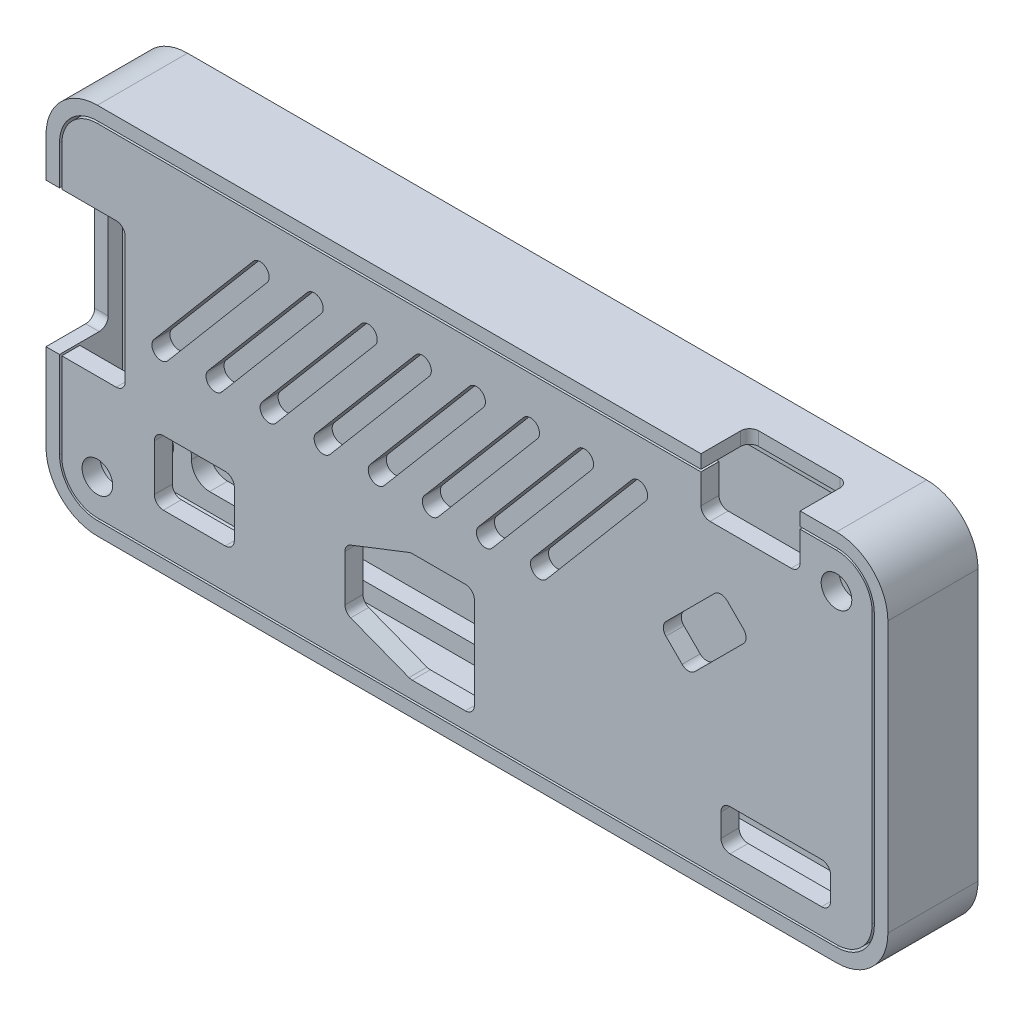
from build123d import *

# Parameters (mm, degrees)
BOSS_EXTRUDE1_DEPTH   = 3
BOSS_EXTRUDE2_START   = 7
BOSS_EXTRUDE2_DEPTH   = 7
M3X0_5_TAPPED_HOLE1_D = 2.9
CUT_EXTRUDE1_DEPTH    = 2
FILLET1_R             = 2
BOSS_EXTRUDE3_DEPTH   = 2
SKETCH6_W             = 8.782
SKETCH6_H             = 16
SKETCH6_W_2           = 8.874
SKETCH6_H_2           = 7.1596
SKETCH6_W_3           = 11
SKETCH6_H_3           = 6
SKETCH6_W_4           = 12.16
SKETCH6_H_4           = 4.54
CUT_EXTRUDE2_DEPTH    = 5.4
FILLET2_R             = 1
CUT_EXTRUDE3_DEPTH    = 2
SKETCH8_R             = 1.7
CUT_EXTRUDE4_DEPTH    = 101.424001115
FILLET3_R             = 1


with BuildPart() as part:
    # Sketch1 → Boss-Extrude1 (new body)
    with BuildSketch(Plane.XY):
        with BuildLine():
            Line((4, 39.7), (86, 39.7))
            ThreePointArc((86, 39.7), (90.030508653, 38.030508653), (91.7, 34))
            Line((91.7, 34), (91.7, 4))
            ThreePointArc((91.7, 4), (90.030508653, -0.030508653), (86, -1.7))
            Line((86, -1.7), (4, -1.7))
            ThreePointArc((4, -1.7), (-0.030508653, -0.030508653), (-1.7, 4))
            Line((-1.7, 4), (-1.7, 34))
            ThreePointArc((-1.7, 34), (-0.030508653, 38.030508653), (4, 39.7))
        make_face()
    extrude(amount=-BOSS_EXTRUDE1_DEPTH)

    # Sketch1<3> → Boss-Extrude2 (add)
    with BuildSketch(Plane.XY.offset(BOSS_EXTRUDE2_START)):
        with BuildLine():
            Line((4, 39.7), (86, 39.7))
            ThreePointArc((86, 39.7), (90.030508653, 38.030508653), (91.7, 34))
            Line((91.7, 34), (91.7, 4))
            ThreePointArc((91.7, 4), (90.030508653, -0.030508653), (86, -1.7))
            Line((86, -1.7), (4, -1.7))
            ThreePointArc((4, -1.7), (-0.030508653, -0.030508653), (-1.7, 4))
            Line((-1.7, 4), (-1.7, 34))
            ThreePointArc((-1.7, 34), (-0.030508653, 38.030508653), (4, 39.7))
        make_face()
        with BuildLine():
            Line((-0.2, 4), (-0.2, 34))
            ThreePointArc((-0.2, 34), (1.030151519, 36.969848481), (4, 38.2))
            Line((4, 38.2), (86, 38.2))
            ThreePointArc((86, 38.2), (88.969848481, 36.969848481), (90.2, 34))
            Line((90.2, 34), (90.2, 4))
            ThreePointArc((90.2, 4), (88.969848481, 1.030151519), (86, -0.2))
            Line((86, -0.2), (4, -0.2))
            ThreePointArc((4, -0.2), (1.030151519, 1.030151519), (-0.2, 4))
        make_face(mode=Mode.SUBTRACT)
    extrude(amount=-BOSS_EXTRUDE2_DEPTH)

    # M3x0.5 Tapped Hole1 (through all)
    with Locations(Plane.XY):
        with Locations((4, 34), (4, 4), (86, 4), (86, 34)):
            Hole(M3X0_5_TAPPED_HOLE1_D / 2)

    # Sketch4 → Cut-Extrude1 (cut)
    with BuildSketch(Plane.XY):
        with BuildLine():
            Line((1.8, 31.342463547), (1.8, 6.657536453))
            ThreePointArc((1.8, 6.657536453), (6.439518395, 6.439518395), (6.657536453, 1.8))
            Line((6.657536453, 1.8), (83.342463547, 1.8))
            ThreePointArc((83.342463547, 1.8), (83.560481605, 6.439518395), (88.2, 6.657536453))
            Line((88.2, 6.657536453), (88.2, 31.342463547))
            ThreePointArc((88.2, 31.342463547), (83.560481605, 31.560481605), (83.342463547, 36.2))
            Line((83.342463547, 36.2), (6.657536453, 36.2))
            ThreePointArc((6.657536453, 36.2), (6.439518395, 31.560481605), (1.8, 31.342463547))
        make_face()
    extrude(amount=-CUT_EXTRUDE1_DEPTH, mode=Mode.SUBTRACT)

    # Fillet1
    fillet1_edges = [part.edges().sort_by_distance(p)[0] for p in [
        (88.2, 6.657536453, -1),
        (83.342463547, 1.8, -1),
        (6.657536453, 1.8, -1),
        (1.8, 6.657536453, -1),
        (1.8, 31.342463547, -1),
        (6.657536453, 36.2, -1),
        (83.342463547, 36.2, -1),
        (88.2, 31.342463547, -1),
    ]]
    fillet(fillet1_edges, radius=FILLET1_R)


with BuildPart() as body_2:
    # Sketch5 → Boss-Extrude3 (new body)
    with BuildSketch(Plane.XY.offset(7)):
        with BuildLine():
            Line((86, 37.95), (4, 37.95))
            ThreePointArc((4, 37.95), (1.206928214, 36.793071786), (0.05, 34))
            Line((0.05, 34), (0.05, 4))
            ThreePointArc((0.05, 4), (1.206928214, 1.206928214), (4, 0.05))
            Line((4, 0.05), (86, 0.05))
            ThreePointArc((86, 0.05), (88.793071786, 1.206928214), (89.95, 4))
            Line((89.95, 4), (89.95, 34))
            ThreePointArc((89.95, 34), (88.793071786, 36.793071786), (86, 37.95))
        make_face()
    extrude(amount=-BOSS_EXTRUDE3_DEPTH)


with BuildPart() as cut_extrude2_tool:
    # Sketch6 → Cut-Extrude2 (new body)
    with BuildSketch(Plane.XY.offset(7)):
        Polygon((38.7456, 14.0852), (31.4652, 11.2392), (31.4652, 4.7392), (38.7456, 1.9252), (45.8256, 1.9252), (45.8256, 14.0852), align=None)
        with Locations((2.691, 21.6504)):
            Rectangle(SKETCH6_W, SKETCH6_H)
        with Locations((14.7534, 8.029)):
            Rectangle(SKETCH6_W_2, SKETCH6_H_2)
        with Locations((76.467, 36.7)):
            Rectangle(SKETCH6_W_3, SKETCH6_H_3)
        Polygon((69.581949, 17.714884213), (66.371684213, 20.925149), (73.174051448, 27.727516235), (76.384316235, 24.517251448), align=None)
        with Locations((79.268, 5.135)):
            Rectangle(SKETCH6_W_4, SKETCH6_H_4)
    extrude(amount=-CUT_EXTRUDE2_DEPTH)


with BuildPart() as part_1:
    add(part.part)

    # Cut-Extrude2: cut by cut_extrude2_tool
    add(cut_extrude2_tool.part, mode=Mode.SUBTRACT)

    # Fillet3
    fillet3_edges = [part_1.edges().sort_by_distance(p)[0] for p in [
        (-0.95, 13.6504, 1.6),
        (-0.95, 29.6504, 1.6),
        (70.967, 38.95, 1.6),
        (81.967, 38.95, 1.6),
    ]]
    fillet(fillet3_edges, radius=FILLET3_R)


with BuildPart() as body_2_1:
    add(body_2.part)

    # Cut-Extrude2: cut by cut_extrude2_tool
    add(cut_extrude2_tool.part, mode=Mode.SUBTRACT)

    # Fillet2
    fillet2_edges = [body_2_1.edges().sort_by_distance(p)[0] for p in [
        (85.348, 7.405, 6),
        (73.188, 7.405, 6),
        (31.4652, 11.2392, 6),
        (31.4652, 4.7392, 6),
        (38.7456, 1.9252, 6),
        (45.8256, 1.9252, 6),
        (45.8256, 14.0852, 6),
        (38.7456, 14.0852, 6),
        (7.082, 29.6504, 6),
        (7.082, 13.6504, 6),
        (10.3164, 4.4492, 6),
        (19.1904, 4.4492, 6),
        (19.1904, 11.6088, 6),
        (10.3164, 11.6088, 6),
        (81.967, 33.7, 6),
        (70.967, 33.7, 6),
        (73.174051448, 27.727516235, 6),
        (66.371684213, 20.925149, 6),
        (69.581949, 17.714884213, 6),
        (76.384316235, 24.517251448, 6),
        (73.188, 2.865, 6),
        (85.348, 2.865, 6),
    ]]
    fillet(fillet2_edges, radius=FILLET2_R)

    # Sketch7 → Cut-Extrude3 (cut)
    with BuildSketch(Plane.XY.offset(7)):
        with BuildLine():
            Line((10.286613715, 20.345942241), (21.286613715, 33.345942241))
            ThreePointArc((21.286613715, 33.345942241), (22.695942241, 33.463386285), (22.813386285, 32.054057759))
            Line((22.813386285, 32.054057759), (11.813386285, 19.054057759))
            ThreePointArc((11.813386285, 19.054057759), (10.404057759, 18.936613715), (10.286613715, 20.345942241))
        make_face()
        with BuildLine():
            Line((16.286613715, 20.345942241), (27.286613715, 33.345942241))
            ThreePointArc((27.286613715, 33.345942241), (28.695942241, 33.463386285), (28.813386285, 32.054057759))
            Line((28.813386285, 32.054057759), (17.813386285, 19.054057759))
            ThreePointArc((17.813386285, 19.054057759), (16.404057759, 18.936613715), (16.286613715, 20.345942241))
        make_face()
        with BuildLine():
            Line((22.286613715, 20.345942241), (33.286613715, 33.345942241))
            ThreePointArc((33.286613715, 33.345942241), (34.695942241, 33.463386285), (34.813386285, 32.054057759))
            Line((34.813386285, 32.054057759), (23.813386285, 19.054057759))
            ThreePointArc((23.813386285, 19.054057759), (22.404057759, 18.936613715), (22.286613715, 20.345942241))
        make_face()
        with BuildLine():
            Line((28.286613715, 20.345942241), (39.286613715, 33.345942241))
            ThreePointArc((39.286613715, 33.345942241), (40.695942241, 33.463386285), (40.813386285, 32.054057759))
            Line((40.813386285, 32.054057759), (29.813386285, 19.054057759))
            ThreePointArc((29.813386285, 19.054057759), (28.404057759, 18.936613715), (28.286613715, 20.345942241))
        make_face()
        with BuildLine():
            Line((34.286613715, 20.345942241), (45.286613715, 33.345942241))
            ThreePointArc((45.286613715, 33.345942241), (46.695942241, 33.463386285), (46.813386285, 32.054057759))
            Line((46.813386285, 32.054057759), (35.813386285, 19.054057759))
            ThreePointArc((35.813386285, 19.054057759), (34.404057759, 18.936613715), (34.286613715, 20.345942241))
        make_face()
        with BuildLine():
            Line((40.286613715, 20.345942241), (51.286613715, 33.345942241))
            ThreePointArc((51.286613715, 33.345942241), (52.695942241, 33.463386285), (52.813386285, 32.054057759))
            Line((52.813386285, 32.054057759), (41.813386285, 19.054057759))
            ThreePointArc((41.813386285, 19.054057759), (40.404057759, 18.936613715), (40.286613715, 20.345942241))
        make_face()
        with BuildLine():
            Line((46.286613715, 20.345942241), (57.286613715, 33.345942241))
            ThreePointArc((57.286613715, 33.345942241), (58.695942241, 33.463386285), (58.813386285, 32.054057759))
            Line((58.813386285, 32.054057759), (47.813386285, 19.054057759))
            ThreePointArc((47.813386285, 19.054057759), (46.404057759, 18.936613715), (46.286613715, 20.345942241))
        make_face()
        with BuildLine():
            Line((52.286613715, 20.345942241), (63.286613715, 33.345942241))
            ThreePointArc((63.286613715, 33.345942241), (64.695942241, 33.463386285), (64.813386285, 32.054057759))
            Line((64.813386285, 32.054057759), (53.813386285, 19.054057759))
            ThreePointArc((53.813386285, 19.054057759), (52.404057759, 18.936613715), (52.286613715, 20.345942241))
        make_face()
    extrude(amount=-CUT_EXTRUDE3_DEPTH, mode=Mode.SUBTRACT)

    # Sketch8 → Cut-Extrude4 (cut, through all)
    with BuildSketch(Plane.XY.offset(7)):
        with Locations((4, 4)):
            Circle(SKETCH8_R)
        with Locations((86, 34)):
            Circle(SKETCH8_R)
    extrude(amount=-CUT_EXTRUDE4_DEPTH, mode=Mode.SUBTRACT)


solid = Compound([part_1.part, body_2_1.part])
